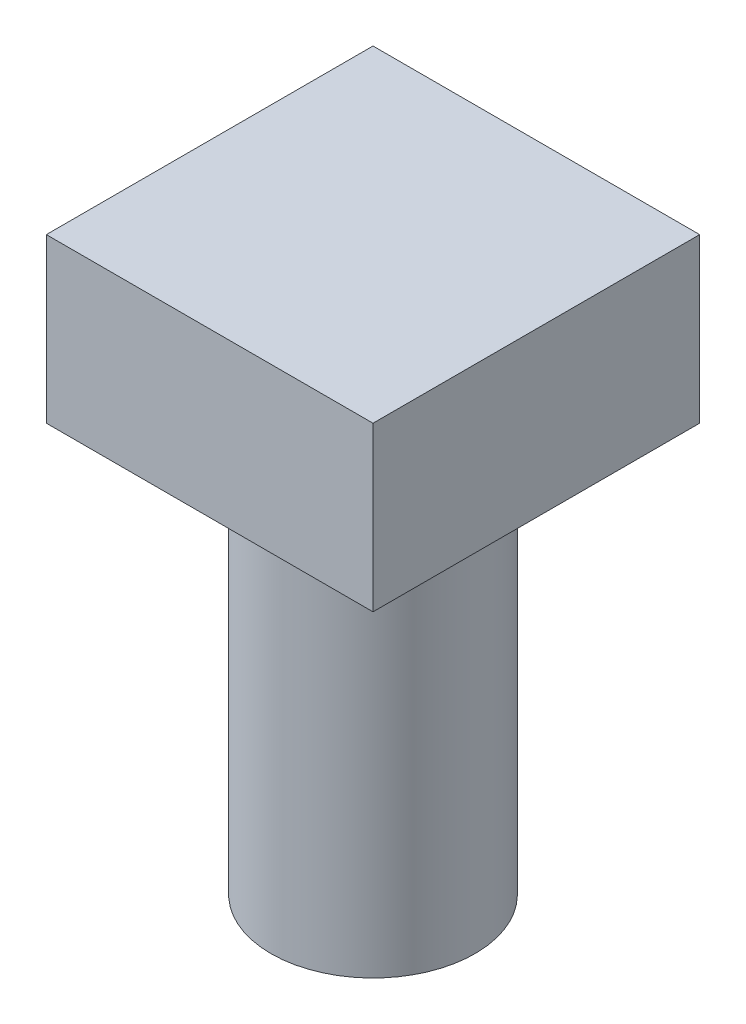
from build123d import *

# Parameters (mm, degrees)
SKETCH1_R           = 3.175
BOSS_EXTRUDE1_DEPTH = 12.7
SKETCH2_W           = 10.16
SKETCH2_H           = 10.16
BOSS_EXTRUDE2_DEPTH = 5.08


with BuildPart() as part:
    # Sketch1 → Boss-Extrude1 (new body)
    with BuildSketch(Plane(origin=(0, 0, 0), x_dir=(1, 0, 0), z_dir=(0, 1, 0))):
        with Locations(Location((0, 0, 0), (0, 0, 270))):
            Circle(SKETCH1_R)
    extrude(amount=BOSS_EXTRUDE1_DEPTH)

    # Sketch2 → Boss-Extrude2 (add)
    with BuildSketch(Plane(origin=(0, 12.7, 0), x_dir=(1, 0, 0), z_dir=(0, 1, 0))):
        Rectangle(SKETCH2_W, SKETCH2_H)
    extrude(amount=BOSS_EXTRUDE2_DEPTH)


solid = part.part
